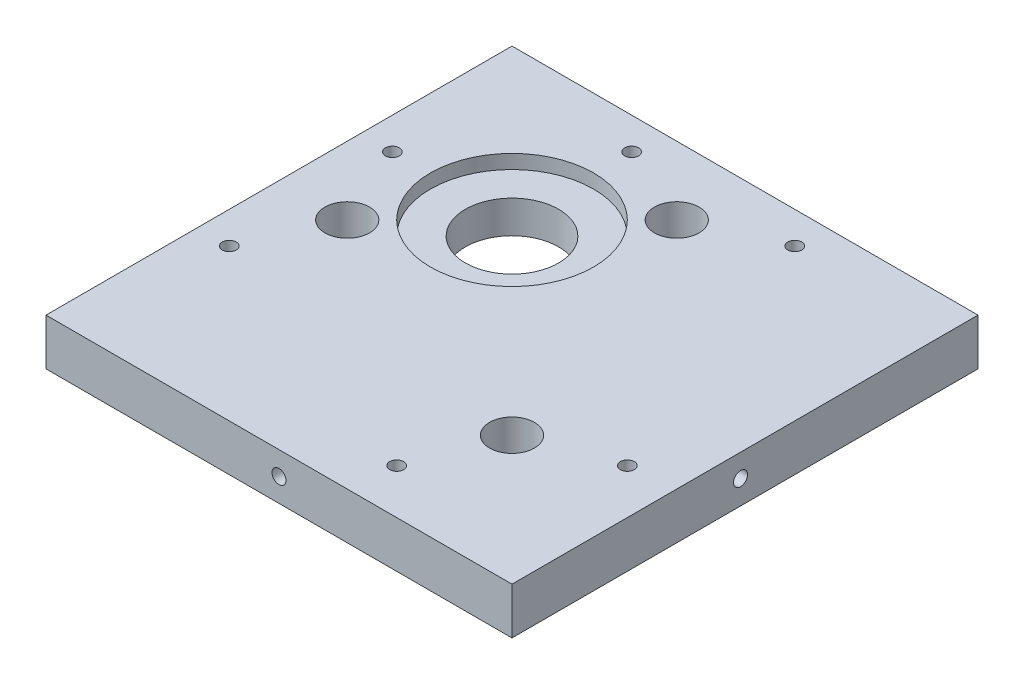
from build123d import *

# Parameters (mm, degrees)
SKETCH1_W           = 100
SKETCH1_H           = 100
BOSS_EXTRUDE1_DEPTH = 10
SKETCH2_R           = 17.5
CUT_EXTRUDE1_DEPTH  = 3
SKETCH4_R           = 10
CUT_EXTRUDE2_DEPTH  = 7
SKETCH5_R           = 4.8
CUT_EXTRUDE3_DEPTH  = 20
SKETCH6_R           = 1.5
CUT_EXTRUDE4_DEPTH  = 5
SKETCH7_R           = 4.8
CUT_EXTRUDE5_DEPTH  = 10
SKETCH8_R           = 1.5
CUT_EXTRUDE6_DEPTH  = 5
SKETCH9_R           = 1.5
CUT_EXTRUDE7_DEPTH  = 5
SKETCH10_R          = 1.5
CUT_EXTRUDE8_DEPTH  = 5
SKETCH11_R          = 1.5
CUT_EXTRUDE9_DEPTH  = 5
CUT_EXTRUDE10_START = -5
SKETCH12_R          = 1.5
CUT_EXTRUDE10_DEPTH = 5


with BuildPart() as part:
    # Sketch1 → Boss-Extrude1 (new body)
    with BuildSketch(Plane(origin=(0, 0, 0), x_dir=(1, 0, 0), z_dir=(0, 1, 0))):
        Rectangle(SKETCH1_W, SKETCH1_H)
    extrude(amount=BOSS_EXTRUDE1_DEPTH)

    # Sketch2 → Cut-Extrude1 (cut)
    with BuildSketch(Plane(origin=(0, 10, 0), x_dir=(1, 0, 0), z_dir=(0, 1, 0))):
        with Locations(Location((-17.67766953, 17.67766953, 0), (0, 0, 270))):
            Circle(SKETCH2_R)
    extrude(amount=-CUT_EXTRUDE1_DEPTH, mode=Mode.SUBTRACT)

    # Sketch4 → Cut-Extrude2 (cut)
    with BuildSketch(Plane(origin=(0, 7, 0), x_dir=(1, 0, 0), z_dir=(0, 1, 0))):
        with Locations(Location((-17.67766953, 17.67766953, 0), (0, 0, 270))):
            Circle(SKETCH4_R)
    extrude(amount=-CUT_EXTRUDE2_DEPTH, mode=Mode.SUBTRACT)

    # Sketch5 → Cut-Extrude3 (cut)
    with BuildSketch(Plane(origin=(0, 10, 0), x_dir=(1, 0, 0), z_dir=(0, 1, 0))):
        with Locations(Location((-35.355339059, 0, 0), (0, 0, 270))):
            Circle(SKETCH5_R)
        with Locations(Location((0, 35.355339059, 0), (0, 0, 270))):
            Circle(SKETCH5_R)
    extrude(amount=-CUT_EXTRUDE3_DEPTH, mode=Mode.SUBTRACT)

    # Sketch6 → Cut-Extrude4 (cut)
    with BuildSketch(Plane(origin=(0, 10, 0), x_dir=(1, 0, 0), z_dir=(0, 1, 0))):
        with Locations(Location((-43.179859239, 17.5, 0), (0, 0, 270))):
            Circle(SKETCH6_R)
        with Locations(Location((-43.179859239, -17.5, 0), (0, 0, 90))):
            Circle(SKETCH6_R)
        with Locations(Location((17.5, 43.179859239, 0), (0, 0, 270))):
            Circle(SKETCH6_R)
        with Locations(Location((-17.5, 43.179859239, 0), (0, 0, 90))):
            Circle(SKETCH6_R)
    extrude(amount=-CUT_EXTRUDE4_DEPTH, mode=Mode.SUBTRACT)

    # Sketch7 → Cut-Extrude5 (cut)
    with BuildSketch(Plane(origin=(0, 10, 0), x_dir=(1, 0, 0), z_dir=(0, 1, 0))):
        with Locations(Location((22.32233047, -22.32233047, 0), (0, 0, 270))):
            Circle(SKETCH7_R)
    extrude(amount=-CUT_EXTRUDE5_DEPTH, mode=Mode.SUBTRACT)

    # Sketch8 → Cut-Extrude6 (cut)
    with BuildSketch(Plane(origin=(0, 10, 0), x_dir=(1, 0, 0), z_dir=(0, 1, 0))):
        with Locations(Location((40.353553391, -15.604816049, 0), (0, 0, 270))):
            Circle(SKETCH8_R)
        with Locations(Location((15.604816049, -40.353553391, 0), (0, 0, 90))):
            Circle(SKETCH8_R)
    extrude(amount=-CUT_EXTRUDE6_DEPTH, mode=Mode.SUBTRACT)

    # Sketch9 → Cut-Extrude7 (cut)
    with BuildSketch(Plane(origin=(50, 0, 0), x_dir=(0, 0, -1), z_dir=(1, 0, 0))):
        with Locations((-0.963309919, 5.096330992)):
            Circle(SKETCH9_R)
    extrude(amount=-CUT_EXTRUDE7_DEPTH, mode=Mode.SUBTRACT)

    # Sketch10 → Cut-Extrude8 (cut)
    with BuildSketch(Plane(origin=(0, 0, -50), x_dir=(-1, 0, 0), z_dir=(0, 0, -1))):
        with Locations((0, 5)):
            Circle(SKETCH10_R)
    extrude(amount=-CUT_EXTRUDE8_DEPTH, mode=Mode.SUBTRACT)

    # Sketch11 → Cut-Extrude9 (cut)
    with BuildSketch(Plane.ZY.offset(50)):
        with Locations((0, 5)):
            Circle(SKETCH11_R)
    extrude(amount=-CUT_EXTRUDE9_DEPTH, mode=Mode.SUBTRACT)

    # Sketch12 → Cut-Extrude10 (cut)
    with BuildSketch(Plane.XY.offset(50).offset(CUT_EXTRUDE10_START)):
        with Locations(Location((0, 5, 0), (0, 0, 180))):
            Circle(SKETCH12_R)
    extrude(amount=CUT_EXTRUDE10_DEPTH, mode=Mode.SUBTRACT)


solid = part.part
